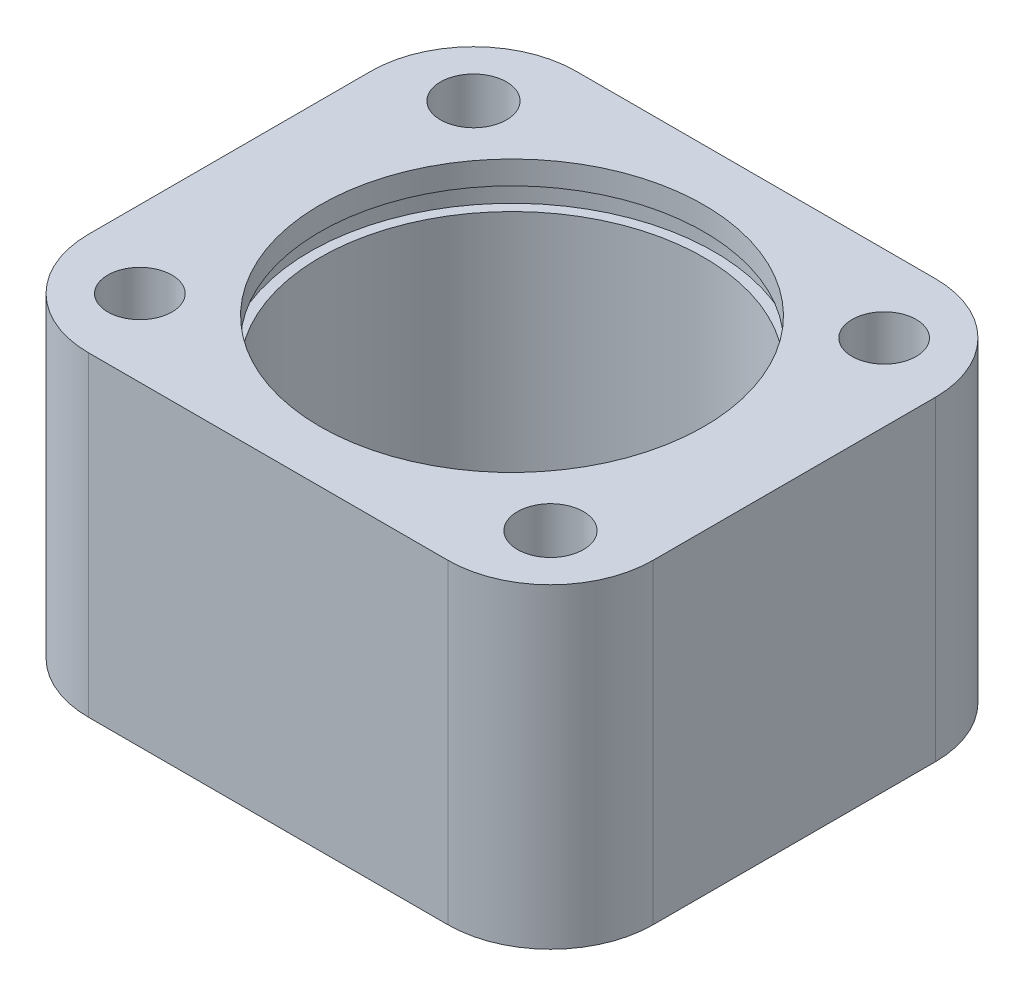
from build123d import *

# Parameters (mm, degrees)
SKETCH1_W                                      = 27.94
SKETCH1_H                                      = 15.621
BOSS_EXTRUDE1_DEPTH                            = 12.065
SKETCH3_R                                      = 9.4996
CUT_EXTRUDE1_DEPTH                             = 14.351
SKETCH4_R                                      = 7.50062
CUT_EXTRUDE3_DEPTH                             = 25.181413648
CBORE_FOR_4_SOCKET_HEAD_CAP_SCREW1_D           = 3.2639
CBORE_FOR_4_SOCKET_HEAD_CAP_SCREW1_CBORE_D     = 5.55752
CBORE_FOR_4_SOCKET_HEAD_CAP_SCREW1_CBORE_DEPTH = 2.8448
FILLET1_R                                      = 5.08
F_1_8_0_1250_DOWEL_HOLE1_D                     = 3.175
F_5_32_0_15625_DIAMETER_HOLE1_D                = 3.96875
F_5_32_0_15625_DIAMETER_HOLE1_DEPTH            = 7.62
F_5_32_0_15625_DIAMETER_HOLE1_TIP              = 1.192332791
CUT_EXTRUDE4_START                             = 12.1
SKETCH14_R                                     = 10
CUT_EXTRUDE4_DEPTH                             = 1.1


with BuildPart() as part:
    # Sketch1 → Boss-Extrude1 (new, symmetric)
    with BuildSketch(Plane.XY):
        Rectangle(SKETCH1_W, SKETCH1_H)
    extrude(amount=BOSS_EXTRUDE1_DEPTH, both=True)

    # Sketch3 → Cut-Extrude1 (cut)
    with BuildSketch(Plane(origin=(0, 7.8105, 0), x_dir=(1, 0, 0), z_dir=(0, 1, 0))):
        with Locations(Location((0, 0, 0), (0, 0, 270))):
            Circle(SKETCH3_R)
    extrude(amount=-CUT_EXTRUDE1_DEPTH, mode=Mode.SUBTRACT)

    # Sketch4 → Cut-Extrude3 (cut, through all)
    with BuildSketch(Plane(origin=(0, 7.8105, 0), x_dir=(1, 0, 0), z_dir=(0, 1, 0))):
        with Locations(Location((0, 0, 0), (0, 0, 270))):
            Circle(SKETCH4_R)
    extrude(amount=-CUT_EXTRUDE3_DEPTH, mode=Mode.SUBTRACT)

    # CBORE for #4 Socket Head Cap Screw1 (through all)
    with Locations(Plane(origin=(0, -7.8105, -5.3975), x_dir=(-1, 0, 0), z_dir=(0, -1, 0))):
        with Locations((10.16, 2.8575), (-10.16, -13.6525)):
            CounterBoreHole(CBORE_FOR_4_SOCKET_HEAD_CAP_SCREW1_D / 2, CBORE_FOR_4_SOCKET_HEAD_CAP_SCREW1_CBORE_D / 2, CBORE_FOR_4_SOCKET_HEAD_CAP_SCREW1_CBORE_DEPTH)

    # Fillet1
    fillet1_edges = [part.edges().sort_by_distance(p)[0] for p in [
        (-13.97, 0, 12.065),
        (13.97, 0, 12.065),
        (-13.97, 0, -12.065),
        (13.97, 0, -12.065),
    ]]
    fillet(fillet1_edges, radius=FILLET1_R)

    # 1/8 (0.1250) Dowel Hole1 (through all)
    with Locations(Plane(origin=(0, -7.8105, 0), x_dir=(-1, 0, 0), z_dir=(0, -1, 0))):
        with Locations((10.16, -8.255), (-10.16, 8.255)):
            Hole(F_1_8_0_1250_DOWEL_HOLE1_D / 2)

    # 5/32 (0.15625) Diameter Hole1
    with Locations(Plane.XZ.offset(7.8105)):
        with Locations((-10.16, 8.255), (10.16, -8.255)):
            Hole(F_5_32_0_15625_DIAMETER_HOLE1_D / 2, depth=F_5_32_0_15625_DIAMETER_HOLE1_DEPTH)
            with Locations((0, 0, -(F_5_32_0_15625_DIAMETER_HOLE1_DEPTH + F_5_32_0_15625_DIAMETER_HOLE1_TIP / 2))):  # 118° drill point
                Cone(0, F_5_32_0_15625_DIAMETER_HOLE1_D / 2, F_5_32_0_15625_DIAMETER_HOLE1_TIP, mode=Mode.SUBTRACT)

    # Sketch14 → Cut-Extrude4 (cut)
    with BuildSketch(Plane(origin=(0, -6.5405, 0), x_dir=(1, 0, 0), z_dir=(0, 1, 0)).offset(CUT_EXTRUDE4_START)):
        with Locations(Location((0, 0, 0), (0, 0, 270))):
            Circle(SKETCH14_R)
    extrude(amount=CUT_EXTRUDE4_DEPTH, mode=Mode.SUBTRACT)


solid = part.part
